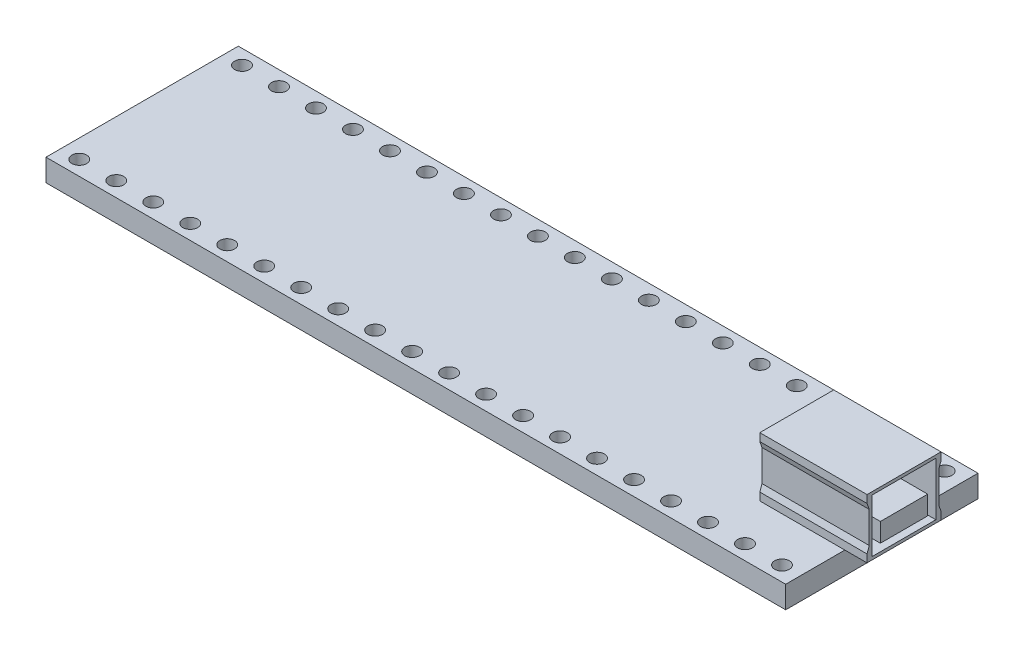
from build123d import *

# Parameters (mm, degrees)
SKETCH_1_W          = 50
SKETCH_1_H          = 13
SKETCH_1_R          = 0.5
EXTRUDE_1_DEPTH     = 1.5
SKETCH_3_W          = 7.25
SKETCH_3_H          = 5
EXTRUDE_2_DEPTH     = 4
SKETCH_4_W          = 7.25
SKETCH_4_H          = 5.5
EXTRUDE_3_DEPTH     = 3
CUT_EXTRUDE_1_DEPTH = 7.25
SKETCH_6_W          = 4.302717404
SKETCH_6_H          = 3.6
SKETCH_6_W_2        = 3.2
SKETCH_6_H_2        = 1.274490689
CUT_EXTRUDE_2_DEPTH = 5


with BuildPart() as part:
    # Эскиз1 → Бобышка-Вытянуть1 (new body)
    with BuildSketch(Plane(origin=(0, 0, 0), x_dir=(1, 0, 0), z_dir=(0, 1, 0))):
        with Locations((25, 6.5)):
            Rectangle(SKETCH_1_W, SKETCH_1_H)
        with Locations(Location((1.25, 12, 0), (0, 0, 270))):
            Circle(SKETCH_1_R, mode=Mode.SUBTRACT)
        with Locations(Location((3.75, 12, 0), (0, 0, 270))):
            Circle(SKETCH_1_R, mode=Mode.SUBTRACT)
        with Locations(Location((6.25, 12, 0), (0, 0, 270))):
            Circle(SKETCH_1_R, mode=Mode.SUBTRACT)
        with Locations(Location((8.75, 12, 0), (0, 0, 270))):
            Circle(SKETCH_1_R, mode=Mode.SUBTRACT)
        with Locations(Location((11.25, 12, 0), (0, 0, 270))):
            Circle(SKETCH_1_R, mode=Mode.SUBTRACT)
        with Locations(Location((13.75, 12, 0), (0, 0, 270))):
            Circle(SKETCH_1_R, mode=Mode.SUBTRACT)
        with Locations(Location((16.25, 12, 0), (0, 0, 270))):
            Circle(SKETCH_1_R, mode=Mode.SUBTRACT)
        with Locations(Location((18.75, 12, 0), (0, 0, 270))):
            Circle(SKETCH_1_R, mode=Mode.SUBTRACT)
        with Locations(Location((21.25, 12, 0), (0, 0, 270))):
            Circle(SKETCH_1_R, mode=Mode.SUBTRACT)
        with Locations(Location((23.75, 12, 0), (0, 0, 270))):
            Circle(SKETCH_1_R, mode=Mode.SUBTRACT)
        with Locations(Location((26.25, 12, 0), (0, 0, 270))):
            Circle(SKETCH_1_R, mode=Mode.SUBTRACT)
        with Locations(Location((28.75, 12, 0), (0, 0, 270))):
            Circle(SKETCH_1_R, mode=Mode.SUBTRACT)
        with Locations(Location((31.25, 12, 0), (0, 0, 270))):
            Circle(SKETCH_1_R, mode=Mode.SUBTRACT)
        with Locations(Location((33.75, 12, 0), (0, 0, 270))):
            Circle(SKETCH_1_R, mode=Mode.SUBTRACT)
        with Locations(Location((36.25, 12, 0), (0, 0, 270))):
            Circle(SKETCH_1_R, mode=Mode.SUBTRACT)
        with Locations(Location((3.75, 1, 0), (0, 0, 270))):
            Circle(SKETCH_1_R, mode=Mode.SUBTRACT)
        with Locations(Location((6.25, 1, 0), (0, 0, 270))):
            Circle(SKETCH_1_R, mode=Mode.SUBTRACT)
        with Locations(Location((8.75, 1, 0), (0, 0, 270))):
            Circle(SKETCH_1_R, mode=Mode.SUBTRACT)
        with Locations(Location((11.25, 1, 0), (0, 0, 270))):
            Circle(SKETCH_1_R, mode=Mode.SUBTRACT)
        with Locations(Location((13.75, 1, 0), (0, 0, 270))):
            Circle(SKETCH_1_R, mode=Mode.SUBTRACT)
        with Locations(Location((16.25, 1, 0), (0, 0, 270))):
            Circle(SKETCH_1_R, mode=Mode.SUBTRACT)
        with Locations(Location((18.75, 1, 0), (0, 0, 270))):
            Circle(SKETCH_1_R, mode=Mode.SUBTRACT)
        with Locations(Location((21.25, 1, 0), (0, 0, 270))):
            Circle(SKETCH_1_R, mode=Mode.SUBTRACT)
        with Locations(Location((23.75, 1, 0), (0, 0, 270))):
            Circle(SKETCH_1_R, mode=Mode.SUBTRACT)
        with Locations(Location((26.25, 1, 0), (0, 0, 270))):
            Circle(SKETCH_1_R, mode=Mode.SUBTRACT)
        with Locations(Location((28.75, 1, 0), (0, 0, 270))):
            Circle(SKETCH_1_R, mode=Mode.SUBTRACT)
        with Locations(Location((31.25, 1, 0), (0, 0, 270))):
            Circle(SKETCH_1_R, mode=Mode.SUBTRACT)
        with Locations(Location((33.75, 1, 0), (0, 0, 270))):
            Circle(SKETCH_1_R, mode=Mode.SUBTRACT)
        with Locations(Location((36.25, 1, 0), (0, 0, 270))):
            Circle(SKETCH_1_R, mode=Mode.SUBTRACT)
        with Locations(Location((1.25, 1, 0), (0, 0, 270))):
            Circle(SKETCH_1_R, mode=Mode.SUBTRACT)
        with Locations(Location((38.75, 12, 0), (0, 0, 270))):
            Circle(SKETCH_1_R, mode=Mode.SUBTRACT)
        with Locations(Location((41.25, 12, 0), (0, 0, 270))):
            Circle(SKETCH_1_R, mode=Mode.SUBTRACT)
        with Locations(Location((43.75, 12, 0), (0, 0, 270))):
            Circle(SKETCH_1_R, mode=Mode.SUBTRACT)
        with Locations(Location((46.25, 12, 0), (0, 0, 270))):
            Circle(SKETCH_1_R, mode=Mode.SUBTRACT)
        with Locations(Location((48.75, 12, 0), (0, 0, 270))):
            Circle(SKETCH_1_R, mode=Mode.SUBTRACT)
        with Locations(Location((38.75, 1, 0), (0, 0, 270))):
            Circle(SKETCH_1_R, mode=Mode.SUBTRACT)
        with Locations(Location((41.25, 1, 0), (0, 0, 270))):
            Circle(SKETCH_1_R, mode=Mode.SUBTRACT)
        with Locations(Location((43.75, 1, 0), (0, 0, 270))):
            Circle(SKETCH_1_R, mode=Mode.SUBTRACT)
        with Locations(Location((46.25, 1, 0), (0, 0, 270))):
            Circle(SKETCH_1_R, mode=Mode.SUBTRACT)
        with Locations(Location((48.75, 1, 0), (0, 0, 270))):
            Circle(SKETCH_1_R, mode=Mode.SUBTRACT)
    extrude(amount=EXTRUDE_1_DEPTH)

    # Эскиз3 → Бобышка-Вытянуть2 (add)
    with BuildSketch(Plane(origin=(0, 1.5, 0), x_dir=(1, 0, 0), z_dir=(0, 1, 0))):
        with Locations((47.875, 6.5)):
            Rectangle(SKETCH_3_W, SKETCH_3_H)
    extrude(amount=EXTRUDE_2_DEPTH)

    # Эскиз4 → Бобышка-Вытянуть3 (add)
    with BuildSketch(Plane.XZ):
        with Locations((34.375, -6.75)):
            Rectangle(SKETCH_4_W, SKETCH_4_H)
    extrude(amount=EXTRUDE_3_DEPTH)

    # Эскиз5 → Вырез-Вытянуть1 (cut)
    with BuildSketch(Plane(origin=(51.5, 0, 0), x_dir=(0, 0, -1), z_dir=(1, 0, 0))):
        Polygon((4.148641298, 4.556809932), (4, 4.976937423), (4, 2.023062577), (4.148641298, 2.443190068), (4.148641298, 3.459627547), (4.148641298, 3.540372453), align=None)
        Polygon((9, 2.023062577), (9, 4.976937423), (8.851358702, 4.556809932), (8.851358702, 3.540372453), (8.851358702, 3.459627547), (8.851358702, 2.443190068), align=None)
    extrude(amount=-CUT_EXTRUDE_1_DEPTH, mode=Mode.SUBTRACT)

    # Эскиз6 → Вырез-Вытянуть2 (cut)
    with BuildSketch(Plane(origin=(51.5, 0, 0), x_dir=(0, 0, -1), z_dir=(1, 0, 0))):
        with Locations((6.5, 3.5)):
            Rectangle(SKETCH_6_W, SKETCH_6_H)
        with Locations((6.5, 2.837245345)):
            Rectangle(SKETCH_6_W_2, SKETCH_6_H_2, mode=Mode.SUBTRACT)
    extrude(amount=-CUT_EXTRUDE_2_DEPTH, mode=Mode.SUBTRACT)


solid = part.part
